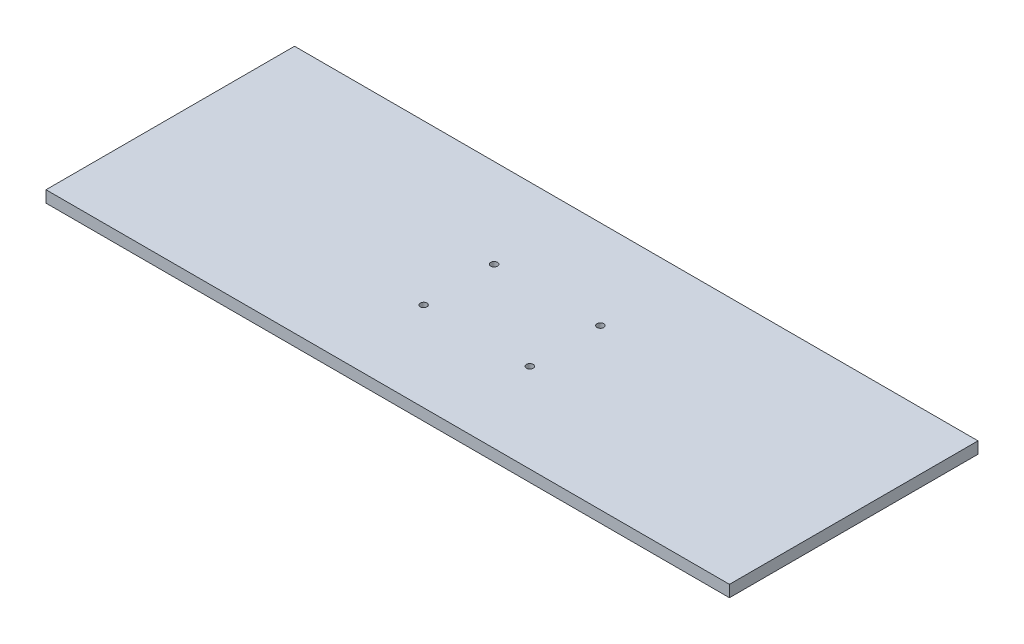
from build123d import *

# Parameters (mm, degrees)
SKETCH1_W                  = 558.8
SKETCH1_H                  = 203.2
TABLE_BLANK_DEPTH          = 9.525
TABLE_HOLES_M5_CLEARANCE_D = 5.5


with BuildPart() as part:
    # Sketch1 → Table Blank (new body)
    with BuildSketch(Plane(origin=(0, 0, 0), x_dir=(1, 0, 0), z_dir=(0, 1, 0))):
        with Locations((279.4, 101.6)):
            Rectangle(SKETCH1_W, SKETCH1_H)
    extrude(amount=TABLE_BLANK_DEPTH)

    # Table Holes (M5 Clearance) (through all)
    with Locations(Plane(origin=(0, 9.525, 0), x_dir=(1, 0, 0), z_dir=(0, 1, 0))):
        with Locations((235.966, 130.429), (322.834, 130.429), (322.834, 72.771), (235.966, 72.771)):
            Hole(TABLE_HOLES_M5_CLEARANCE_D / 2)


solid = part.part
